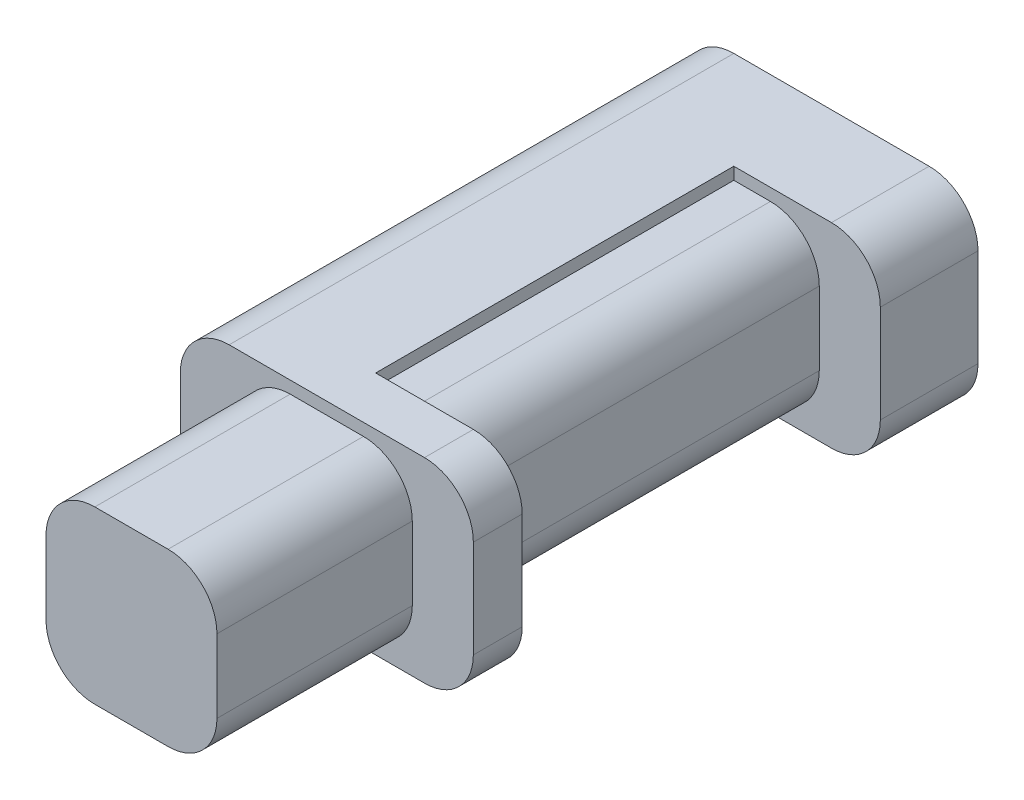
from build123d import *

# Parameters (mm, degrees)
BOSS_EXTRUDE1_DEPTH = 40
BOSS_EXTRUDE2_DEPTH = 3
BOSS_EXTRUDE3_START = 25
BOSS_EXTRUDE3_DEPTH = 25
BOSS_EXTRUDE4_START = -12
BOSS_EXTRUDE4_DEPTH = 3


with BuildPart() as part:
    # Sketch1 → Boss-Extrude1 (new body)
    with BuildSketch(Plane.XY):
        with BuildLine():
            Line((-2.25, 5.25), (2.25, 5.25))
            ThreePointArc((2.25, 5.25), (4.371320344, 4.371320344), (5.25, 2.25))
            Line((5.25, 2.25), (5.25, -2.25))
            ThreePointArc((5.25, -2.25), (4.371320344, -4.371320344), (2.25, -5.25))
            Line((2.25, -5.25), (-2.25, -5.25))
            ThreePointArc((-2.25, -5.25), (-4.371320344, -4.371320344), (-5.25, -2.25))
            Line((-5.25, -2.25), (-5.25, 2.25))
            ThreePointArc((-5.25, 2.25), (-4.371320344, 4.371320344), (-2.25, 5.25))
        make_face()
    extrude(amount=BOSS_EXTRUDE1_DEPTH)

    # Sketch2 → Boss-Extrude2 (add, symmetric)
    with BuildSketch(Plane.XY):
        with BuildLine():
            Line((8.999999945, -3.000810302), (8.999999945, 2.999189698))
            ThreePointArc((8.999999945, 2.999189698), (8.121463527, 5.120366794), (6.000405096, 5.999189671))
            Line((6.000405096, 5.999189671), (-5.999594794, 6.000810275))
            ThreePointArc((-5.999594794, 6.000810275), (-8.121177041, 5.122273883), (-8.999999945, 3.000810302))
            Line((-8.999999945, 3.000810302), (-8.999999945, -2.999189698))
            ThreePointArc((-8.999999945, -2.999189698), (-8.121463527, -5.120366794), (-6.000405096, -5.999189671))
            Line((-6.000405096, -5.999189671), (5.999594794, -6.000810275))
            ThreePointArc((5.999594794, -6.000810275), (8.121177041, -5.122273883), (8.999999945, -3.000810302))
        make_face()
    extrude(amount=BOSS_EXTRUDE2_DEPTH, both=True)

    # Sketch3 → Boss-Extrude3 (add)
    with BuildSketch(Plane.XY.offset(3).offset(BOSS_EXTRUDE3_START)):
        with BuildLine():
            Line((0.000405151, 5.25), (-5.999999945, 5.25))
            ThreePointArc((-5.999999945, 5.25), (-7.590417233, 4.59122759), (-8.249189643, 3.000810302))
            Line((-8.249189643, 3.000810302), (-8.249189643, -2.999189698))
            ThreePointArc((-8.249189643, -2.999189698), (-7.590631979, -4.58939221), (-6.000607381, -5.248379314))
            Line((-6.000607381, -5.248379314), (0.000405151, -5.25))
            Line((0.000405151, -5.25), (0.000405151, -6.000000082))
            Line((0.000405151, -6.000000082), (-6.000405096, -5.999189671))
            ThreePointArc((-6.000405096, -5.999189671), (-8.121463527, -5.120366794), (-8.999999945, -2.999189698))
            Line((-8.999999945, -2.999189698), (-8.999999945, 3.000810302))
            ThreePointArc((-8.999999945, 3.000810302), (-8.121177041, 5.122273883), (-5.999594794, 6.000810275))
            Line((-5.999594794, 6.000810275), (0.000405151, 5.999999973))
            Line((0.000405151, 5.999999973), (0.000405151, 5.25))
        make_face()
    extrude(amount=-BOSS_EXTRUDE3_DEPTH)

    # Sketch5 → Boss-Extrude4 (add)
    with BuildSketch(Plane.XY.offset(40).offset(BOSS_EXTRUDE4_START)):
        with BuildLine():
            Line((0.000405151, -6.000000082), (5.999594794, -6.000810275))
            ThreePointArc((5.999594794, -6.000810275), (8.121177041, -5.122273883), (8.999999945, -3.000810302))
            Line((8.999999945, -3.000810302), (8.999999945, 2.999189698))
            ThreePointArc((8.999999945, 2.999189698), (8.121463527, 5.120366794), (6.000405096, 5.999189671))
            Line((6.000405096, 5.999189671), (0.000405151, 5.999999973))
            Line((0.000405151, 5.999999973), (-5.999594794, 6.000810275))
            ThreePointArc((-5.999594794, 6.000810275), (-8.121177041, 5.122273883), (-8.999999945, 3.000810302))
            Line((-8.999999945, 3.000810302), (-8.999999945, -2.999189698))
            ThreePointArc((-8.999999945, -2.999189698), (-8.121463527, -5.120366794), (-6.000405096, -5.999189671))
            Line((-6.000405096, -5.999189671), (0.000405151, -6.000000082))
        make_face()
    extrude(amount=-BOSS_EXTRUDE4_DEPTH)


solid = part.part
